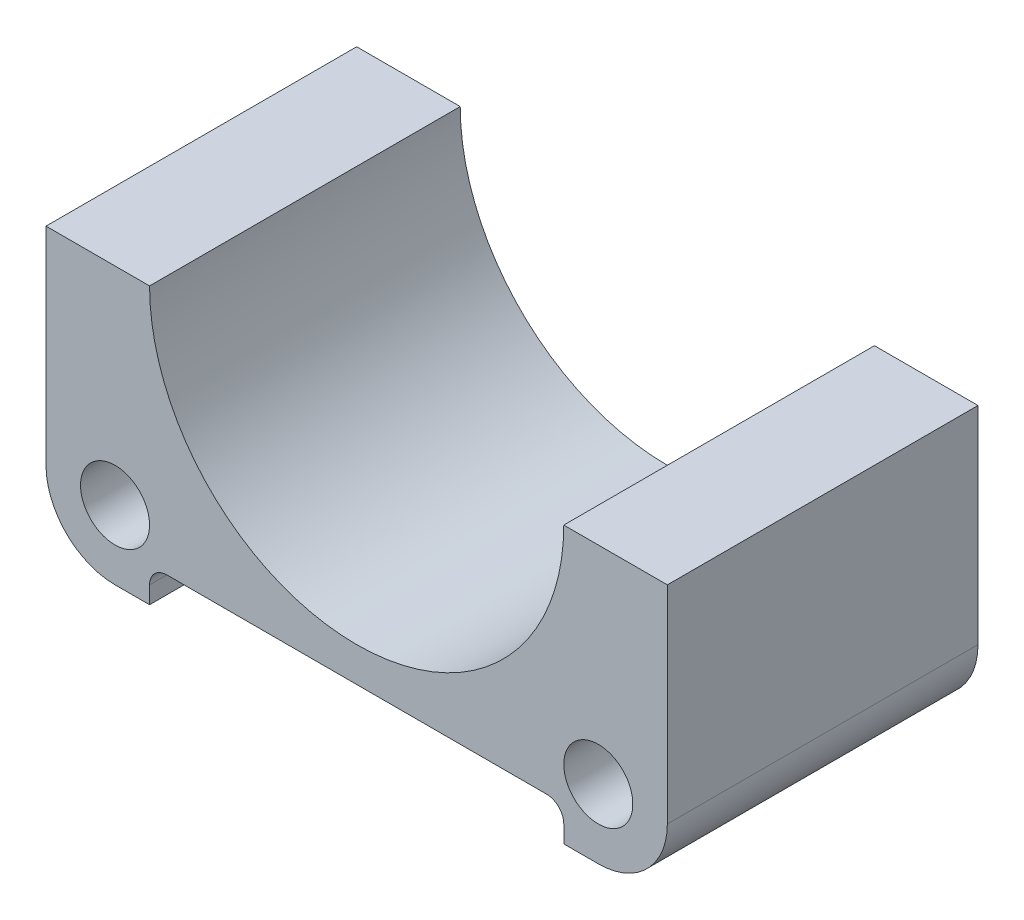
from build123d import *

# Parameters (mm, degrees)
SKETCH1_R           = 10
BOSS_EXTRUDE1_DEPTH = 90


with BuildPart() as part:
    # Sketch1 → Boss-Extrude1 (new body)
    with BuildSketch(Plane.XY):
        with BuildLine():
            Line((60, 40), (90, 40))
            Line((90, 40), (90, -20))
            ThreePointArc((90, -20), (84.142135624, -34.142135624), (70, -40))
            Line((70, -40), (60, -40))
            Line((60, -40), (60, -35))
            ThreePointArc((60, -35), (58.535533906, -31.464466094), (55, -30))
            Line((55, -30), (-55, -30))
            ThreePointArc((-55, -30), (-58.535533906, -31.464466094), (-60, -35))
            Line((-60, -35), (-60, -40))
            Line((-60, -40), (-70, -40))
            ThreePointArc((-70, -40), (-84.142135624, -34.142135624), (-90, -20))
            Line((-90, -20), (-90, 40))
            Line((-90, 40), (-60, 40))
            ThreePointArc((-60, 40), (0, -20), (60, 40))
        make_face()
        with Locations(Location((-70, -20, 0), (0, 0, 180))):
            Circle(SKETCH1_R, mode=Mode.SUBTRACT)
        with Locations(Location((70, -20, 0), (0, 0, 180))):
            Circle(SKETCH1_R, mode=Mode.SUBTRACT)
    extrude(amount=BOSS_EXTRUDE1_DEPTH)


solid = part.part
